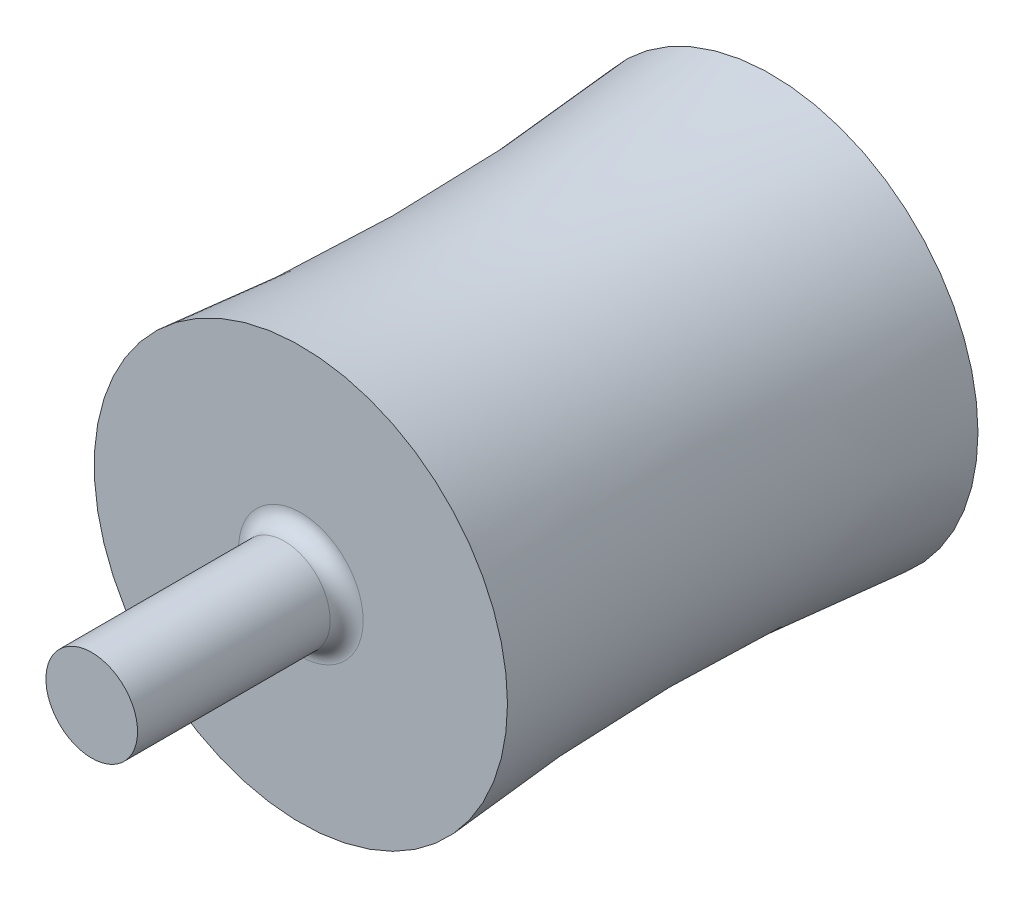
from build123d import *

# Parameters (mm, degrees)
ESQUISSE1_R             = 25.099999965
BOSS_EXTRU_1_DEPTH      = 57.15
ESQUISSE2_R             = 21.25
ENL_V_MAT_EXTRU_1_DEPTH = 53.975
ESQUISSE3_R             = 5.565233599
BOSS_EXTRU_2_DEPTH      = 25.4
CONG_1_R                = 2
CONG_2_R                = 2


with BuildPart() as part:
    # Esquisse1 → Boss.-Extru.1 (new body)
    with BuildSketch(Plane.XY):
        Circle(ESQUISSE1_R)
    extrude(amount=BOSS_EXTRU_1_DEPTH)

    # Esquisse2 → Enlèv. mat.-Extru.1 (cut)
    with BuildSketch(Plane(origin=(0, 0, 0), x_dir=(-1, 0, 0), z_dir=(0, 0, -1))):
        Circle(ESQUISSE2_R)
    extrude(amount=-ENL_V_MAT_EXTRU_1_DEPTH, mode=Mode.SUBTRACT)

    # Esquisse3 → Boss.-Extru.2 (add)
    with BuildSketch(Plane.XY.offset(57.15)):
        Circle(ESQUISSE3_R)
    extrude(amount=BOSS_EXTRU_2_DEPTH)

    # Congé1
    cong_1_edges = [part.edges().sort_by_distance(p)[0] for p in [
        (21.25, 0, 0),
    ]]
    fillet(cong_1_edges, radius=CONG_1_R)

    # Congé2
    cong_2_edges = [part.edges().sort_by_distance(p)[0] for p in [
        (-5.565233599, 0, 57.15),
    ]]
    fillet(cong_2_edges, radius=CONG_2_R)

    # Esquisse4 → Enlèvement de matière-Révolution1 (revolve, cut)
    with BuildSketch(Plane(origin=(0, 0, 0), x_dir=(0, 0, -1), z_dir=(1, 0, 0)), mode=Mode.PRIVATE) as enl_vement_de_mati_re_r_volution1_sk:
        with BuildLine():
            Line((-57.15, 25.099999965), (0, 25.099999965))
            ThreePointArc((0, 25.099999965), (-28.575, 23.487538039), (-57.15, 25.099999965))
        make_face()
    revolve(enl_vement_de_mati_re_r_volution1_sk.sketch.rotate(Axis((0, 0, 82.55), (0, 0, -1)), 90), axis=Axis((0, 0, 82.55), (0, 0, -1)), mode=Mode.SUBTRACT)


solid = part.part
